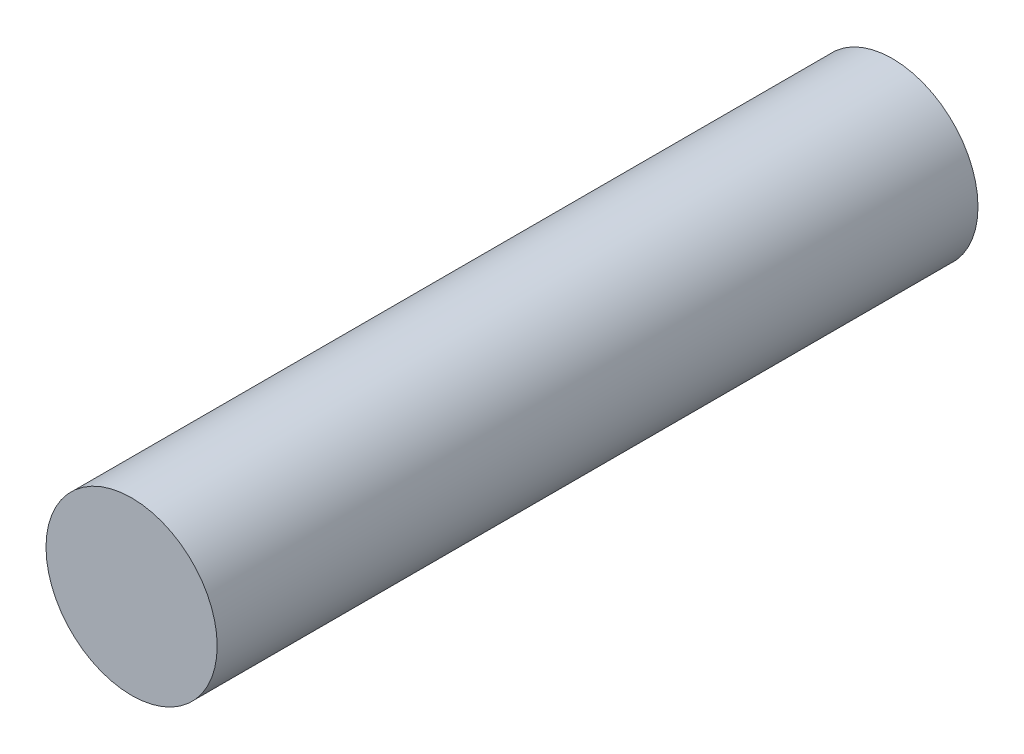
from build123d import *

# Parameters (mm, degrees)
SKETCH_1_R      = 4.5
EXTRUDE_1_DEPTH = 40


with BuildPart() as part:
    # 草图1 → 凸台-拉伸1 (new body)
    with BuildSketch(Plane.XY):
        Circle(SKETCH_1_R)
    extrude(amount=EXTRUDE_1_DEPTH)


solid = part.part
